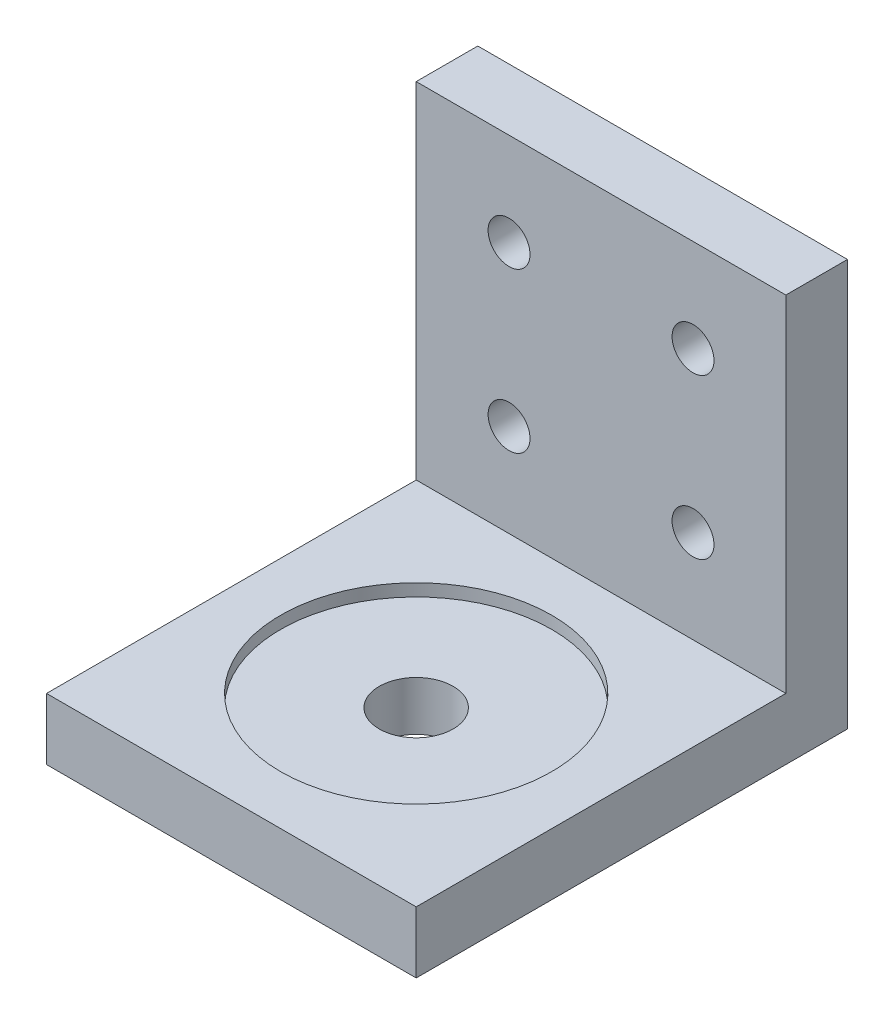
from build123d import *

# Parameters (mm, degrees)
SKETCH1_W           = 30
SKETCH1_H           = 30
BOSS_EXTRUDE1_DEPTH = 5
SKETCH2_R           = 11
CUT_EXTRUDE1_DEPTH  = 1
SKETCH5_W           = 30
SKETCH5_H           = 5
BOSS_EXTRUDE3_DEPTH = 33
SKETCH6_R           = 1.7
CUT_EXTRUDE2_DEPTH  = 9.378
SKETCH7_R           = 3
CUT_EXTRUDE3_DEPTH  = 9.378


with BuildPart() as part:
    # Sketch1 → Boss-Extrude1 (new body)
    with BuildSketch(Plane(origin=(0, 0, 0), x_dir=(1, 0, 0), z_dir=(0, 1, 0))):
        with Locations((0, -3.665024631)):
            Rectangle(SKETCH1_W, SKETCH1_H)
    extrude(amount=BOSS_EXTRUDE1_DEPTH)

    # Sketch2 → Cut-Extrude1 (cut)
    with BuildSketch(Plane(origin=(0, 5, 0), x_dir=(1, 0, 0), z_dir=(0, 1, 0))):
        with Locations(Location((0, -3.665024631, 0), (0, 0, 270))):
            Circle(SKETCH2_R)
    extrude(amount=-CUT_EXTRUDE1_DEPTH, mode=Mode.SUBTRACT)

    # Sketch5 → Boss-Extrude3 (add)
    with BuildSketch(Plane(origin=(0, 0, 0), x_dir=(1, 0, 0), z_dir=(0, 1, 0))):
        with Locations((0, 13.834975369)):
            Rectangle(SKETCH5_W, SKETCH5_H)
    extrude(amount=BOSS_EXTRUDE3_DEPTH)

    # Sketch6 → Cut-Extrude2 (cut)
    with BuildSketch(Plane.XY.offset(-11.334975369)):
        with Locations((-7.464356525, 12.532459144)):
            Circle(SKETCH6_R)
        with Locations((7.464356525, 12.532459144)):
            Circle(SKETCH6_R)
        with Locations((7.464356525, 25.467540856)):
            Circle(SKETCH6_R)
        with Locations((-7.464356525, 25.467540856)):
            Circle(SKETCH6_R)
    extrude(amount=-CUT_EXTRUDE2_DEPTH, mode=Mode.SUBTRACT)

    # Sketch7 → Cut-Extrude3 (cut)
    with BuildSketch(Plane(origin=(0, 4, 0), x_dir=(1, 0, 0), z_dir=(0, 1, 0))):
        with Locations(Location((0, -3.665024631, 0), (0, 0, 270))):
            Circle(SKETCH7_R)
    extrude(amount=-CUT_EXTRUDE3_DEPTH, mode=Mode.SUBTRACT)


solid = part.part
